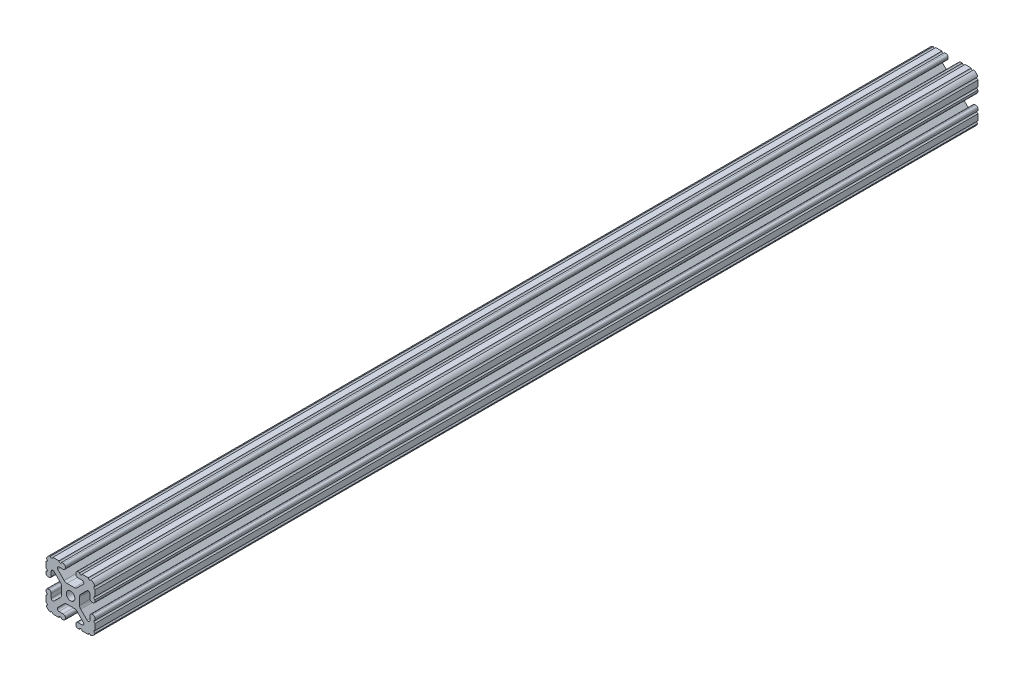
from build123d import *

# Parameters (mm, degrees)
BOSS_EXTRUDE1_DEPTH     = 342.5
CUT_EXTRUDE1_DEPTH      = 344.557935434
CUT_EXTRUDE1_DEPTH_BACK = 344.557935434
SKETCH5_R               = 1.016


with BuildPart() as part:
    # Sketch4 → Boss-Extrude1 (new, symmetric)
    with BuildSketch(Plane.XY):
        with BuildLine():
            Line((5.7912, -19.05), (14.3002, -19.05))
            ThreePointArc((14.3002, -19.05), (17.658815789, -17.658815789), (19.05, -14.3002))
            Line((19.05, -14.3002), (19.05, -5.7912))
            ThreePointArc((19.05, -5.7912), (18.544114832, -4.569885168), (17.3228, -4.064))
            Line((17.3228, -4.064), (16.7132, -4.064))
            ThreePointArc((16.7132, -4.064), (15.491885168, -4.569885168), (14.986, -5.7912))
            Line((14.986, -5.7912), (14.986, -8.996305235))
            ThreePointArc((14.986, -8.996305235), (14.189232738, -10.188751711), (12.782646215, -9.908964256))
            Line((12.782646215, -9.908964256), (7.888897763, -5.015215804))
            ThreePointArc((7.888897763, -5.015215804), (7.219915375, -4.014012907), (6.985, -2.833013566))
            Line((6.985, -2.833013566), (6.985, 0))
            Line((6.985, 0), (3.3274, 0))
            ThreePointArc((3.3274, 0), (2.352827104, -2.352827104), (0, -3.3274))
            Line((0, -3.3274), (0, -6.985))
            Line((0, -6.985), (2.833013566, -6.985))
            ThreePointArc((2.833013566, -6.985), (4.014012907, -7.219915375), (5.015215804, -7.888897763))
            Line((5.015215804, -7.888897763), (9.908964256, -12.782646215))
            ThreePointArc((9.908964256, -12.782646215), (10.188751711, -14.189232738), (8.996305235, -14.986))
            Line((8.996305235, -14.986), (5.7912, -14.986))
            ThreePointArc((5.7912, -14.986), (4.569885168, -15.491885168), (4.064, -16.7132))
            Line((4.064, -16.7132), (4.064, -17.3228))
            ThreePointArc((4.064, -17.3228), (4.569885168, -18.544114832), (5.7912, -19.05))
        make_face()
    extrude(amount=BOSS_EXTRUDE1_DEPTH, both=True)

    # Sketch5 → Cut-Extrude1 (cut, two sides: drawn at the far end of the back side and taken through both)
    with BuildSketch(Plane.XY.offset(-CUT_EXTRUDE1_DEPTH_BACK)):
        with Locations((14.739477062, -19.05)):
            Circle(SKETCH5_R)
        with Locations((7.980305235, -19.05)):
            Circle(SKETCH5_R)
        with Locations((19.05, -14.739477062)):
            Circle(SKETCH5_R)
        with Locations((19.05, -7.980305235)):
            Circle(SKETCH5_R)
    extrude(amount=CUT_EXTRUDE1_DEPTH + CUT_EXTRUDE1_DEPTH_BACK, mode=Mode.SUBTRACT)

    # Mirror1: part across plane


with BuildPart() as part_1:
    add(part.part)
    add(part.part.mirror(Plane(origin=(0, 0, 0), x_dir=(0, 0, 1), z_dir=(1, 0, 0))))

    # Mirror2: part across plane


with BuildPart() as part_2:
    add(part_1.part)
    add(part_1.part.mirror(Plane.ZX))


solid = part_2.part
